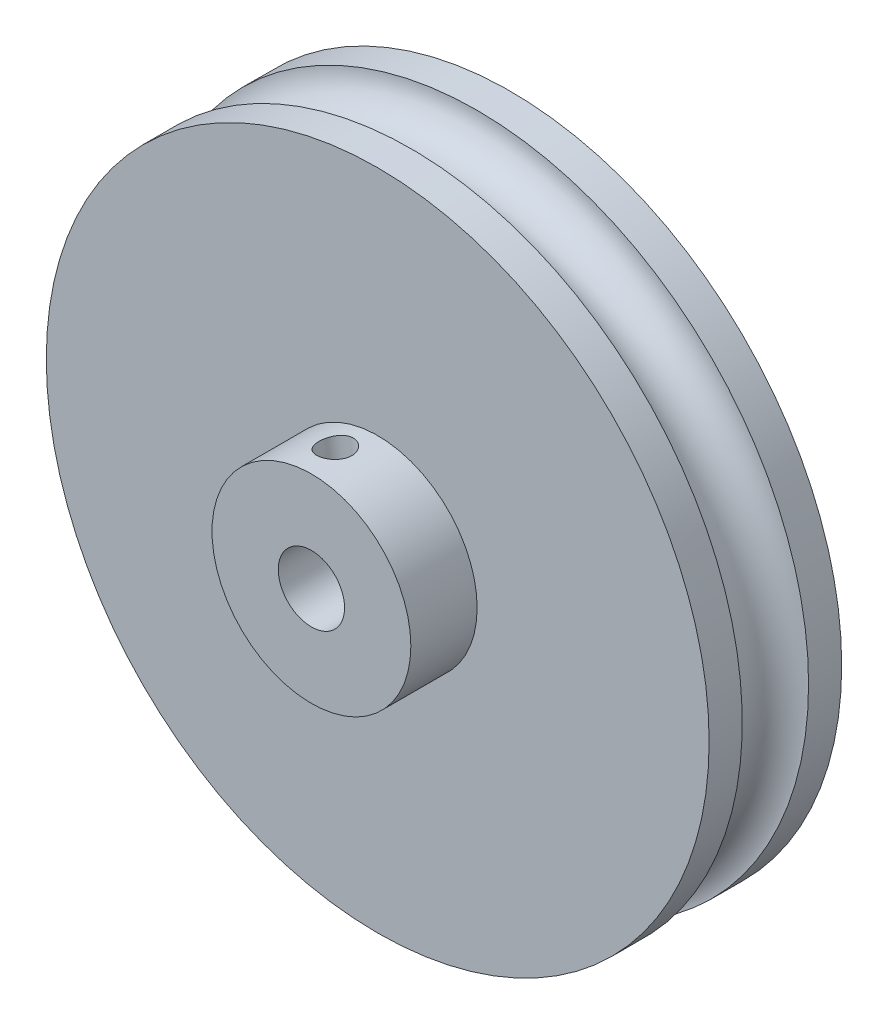
from build123d import *

# Parameters (mm, degrees)
ESQUISSE1_R             = 25
BOSS_EXTRU_1_DEPTH      = 10
ESQUISSE2_R             = 2.5
ESQUISSE5_R             = 7.5
BOSS_EXTRU_3_DEPTH      = 5
ESQUISSE6_R             = 2.5
ENL_V_MAT_EXTRU_2_DEPTH = 39.405728739
TROU_TARAUD_M31_D       = 2.5
TROU_TARAUD_M31_DEPTH   = 8.5
TROU_TARAUD_M31_TIP     = 0.751075774


with BuildPart() as part:
    # Esquisse1 → Boss.-Extru.1 (new body)
    with BuildSketch(Plane.XY):
        Circle(ESQUISSE1_R)
    extrude(amount=BOSS_EXTRU_1_DEPTH)

    # Esquisse2 → Enlèvement de matière-Révolution1 (revolve, cut)
    with BuildSketch(Plane(origin=(0, 0, 0), x_dir=(1, 0, 0), z_dir=(0, 1, 0))):
        with Locations((-25, -5)):
            Circle(ESQUISSE2_R)
    revolve(axis=Axis((0, 0, 0), (0, 0, 1)), mode=Mode.SUBTRACT)

    # Esquisse5 → Boss.-Extru.3 (add)
    with BuildSketch(Plane.XY.offset(10)):
        Circle(ESQUISSE5_R)
    extrude(amount=BOSS_EXTRU_3_DEPTH)

    # Esquisse6 → Enlèv. mat.-Extru.2 (cut, through all)
    with BuildSketch(Plane.XY.offset(15)):
        Circle(ESQUISSE6_R)
    extrude(amount=-ENL_V_MAT_EXTRU_2_DEPTH, mode=Mode.SUBTRACT)

    # Trou taraudé M31
    with Locations(Plane(origin=(-0.924122453, 7.442848762, 12.279526522), x_dir=(0.992379834907, 0.123216327128, 0), z_dir=(-0.123216327128, 0.992379834907, 0))):
        with Locations((0, 0)):
            Hole(TROU_TARAUD_M31_D / 2, depth=TROU_TARAUD_M31_DEPTH)
            with Locations((0, 0, -(TROU_TARAUD_M31_DEPTH + TROU_TARAUD_M31_TIP / 2))):  # 118° drill point
                Cone(0, TROU_TARAUD_M31_D / 2, TROU_TARAUD_M31_TIP, mode=Mode.SUBTRACT)


solid = part.part
